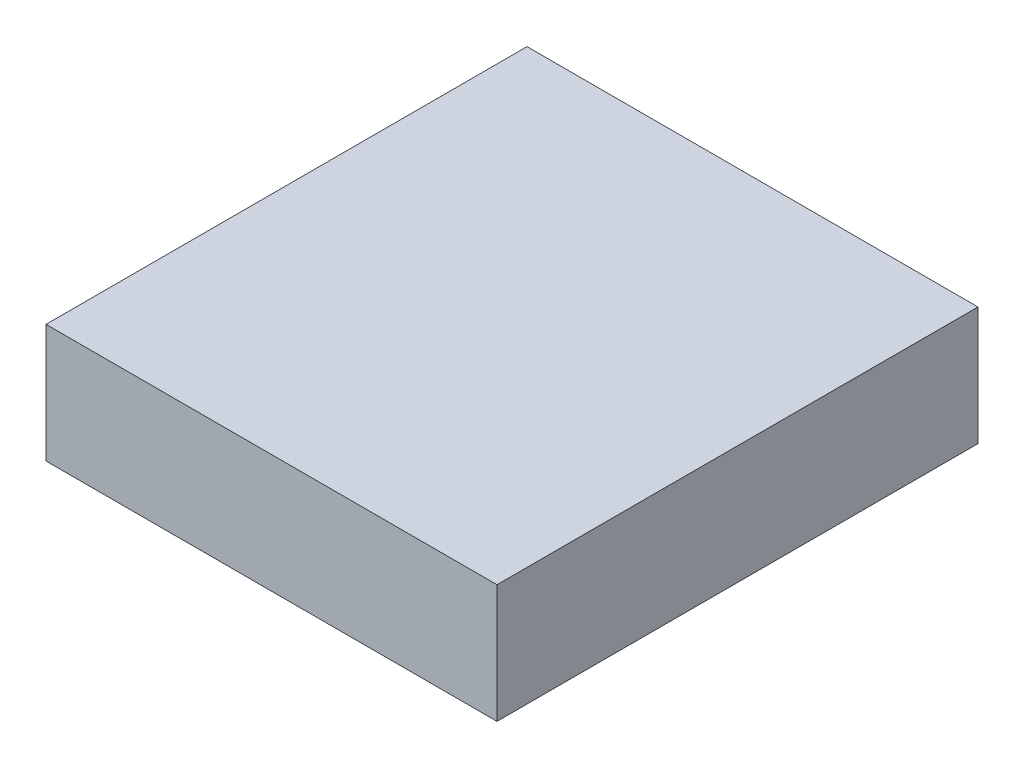
from build123d import *

# Parameters (mm, degrees)
SKETCH1_W           = 95.25
SKETCH1_H           = 101.6
BOSS_EXTRUDE1_DEPTH = 25


with BuildPart() as part:
    # Sketch1 → Boss-Extrude1 (new body)
    with BuildSketch(Plane(origin=(0, 0, 0), x_dir=(1, 0, 0), z_dir=(0, 1, 0))):
        Rectangle(SKETCH1_W, SKETCH1_H)
    extrude(amount=BOSS_EXTRUDE1_DEPTH)


solid = part.part
